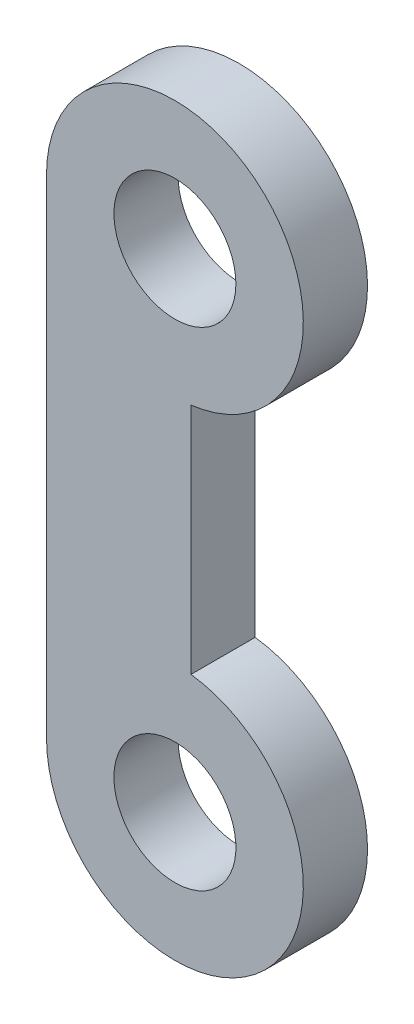
from build123d import *

# Parameters (mm, degrees)
SKETCH1_R           = 1.9
BOSS_EXTRUDE1_DEPTH = 2


with BuildPart() as part:
    # Sketch1 → Boss-Extrude1 (new body)
    with BuildSketch(Plane.XY):
        with BuildLine():
            Line((-0.126223669, 3.632728694), (-0.126223669, -3.632728694))
            ThreePointArc((-0.126223669, -3.632728694), (2.019527642, -10.601355661), (-4.626223669, -7.601355661))
            Line((-4.626223669, -7.601355661), (-4.626223669, 7.601355661))
            ThreePointArc((-4.626223669, 7.601355661), (2.019527642, 10.601355661), (-0.126223669, 3.632728694))
        make_face()
        with Locations((-0.626223669, 7.601355661)):
            Circle(SKETCH1_R, mode=Mode.SUBTRACT)
        with Locations(Location((-0.626223669, -7.601355661, 0), (0, 0, 180))):
            Circle(SKETCH1_R, mode=Mode.SUBTRACT)
    extrude(amount=BOSS_EXTRUDE1_DEPTH)


solid = part.part
